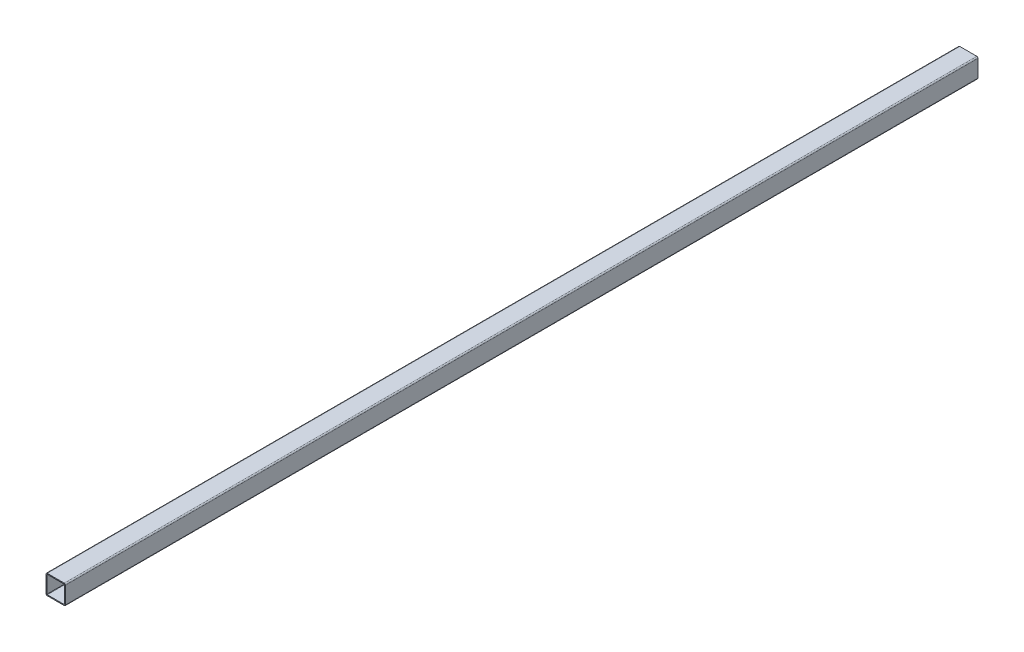
from build123d import *

# Parameters (mm, degrees)
BOSS_EXTRUDE1_DEPTH      = 750
BOSS_EXTRUDE1_DEPTH_BACK = 750


with BuildPart() as part:
    # Sketch1 → Boss-Extrude1 (new, two sides: drawn at the far end of the back side and taken through both)
    with BuildSketch(Plane.XY.offset(-BOSS_EXTRUDE1_DEPTH_BACK)):
        with BuildLine():
            Line((-14, -16), (14, -16))
            ThreePointArc((14, -16), (15.414213562, -15.414213562), (16, -14))
            Line((16, -14), (16, 14))
            ThreePointArc((16, 14), (15.414213562, 15.414213562), (14, 16))
            Line((14, 16), (-14, 16))
            ThreePointArc((-14, 16), (-15.414213562, 15.414213562), (-16, 14))
            Line((-16, 14), (-16, -14))
            ThreePointArc((-16, -14), (-15.414213562, -15.414213562), (-14, -16))
        make_face()
        with BuildLine():
            Line((-14, 14.48), (14, 14.48))
            ThreePointArc((14, 14.48), (14.339411255, 14.339411255), (14.48, 14))
            Line((14.48, 14), (14.48, -14))
            ThreePointArc((14.48, -14), (14.339411255, -14.339411255), (14, -14.48))
            Line((14, -14.48), (-14, -14.48))
            ThreePointArc((-14, -14.48), (-14.339411255, -14.339411255), (-14.48, -14))
            Line((-14.48, -14), (-14.48, 14))
            ThreePointArc((-14.48, 14), (-14.339411255, 14.339411255), (-14, 14.48))
        make_face(mode=Mode.SUBTRACT)
    extrude(amount=BOSS_EXTRUDE1_DEPTH + BOSS_EXTRUDE1_DEPTH_BACK)


solid = part.part
